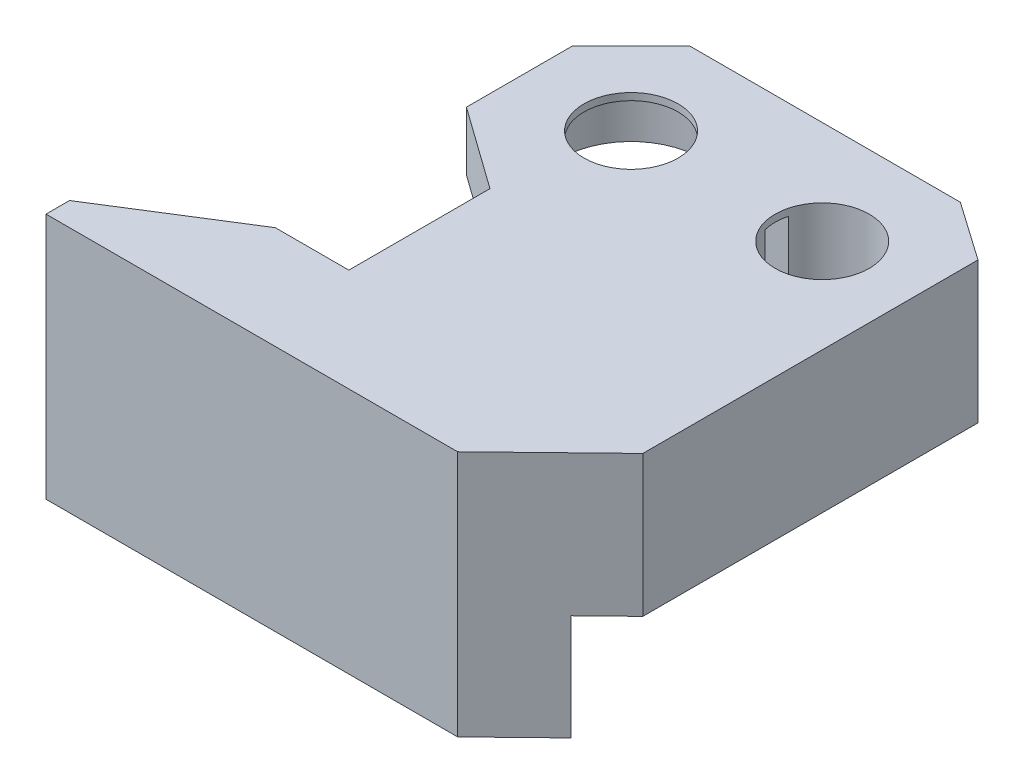
from build123d import *
from build123d.topology import SkipClean

# Parameters (mm, degrees)
SKETCH1_R           = 4
BOSS_EXTRUDE1_DEPTH = 5
BOSS_EXTRUDE2_DEPTH = 7
BOSS_EXTRUDE3_DEPTH = 16
BOSS_EXTRUDE4_START = 2.5
SKETCH6_R           = 7
SKETCH6_R_2         = 4
BOSS_EXTRUDE4_DEPTH = 2.5
CUT_EXTRUDE1_DEPTH  = 4.4
CUT_EXTRUDE2_DEPTH  = 45.33083013


with BuildPart() as part:
    # Sketch1 → Boss-Extrude1 (new body)
    with BuildSketch(Plane(origin=(0, 0, 0), x_dir=(1, 0, 0), z_dir=(0, 1, 0))):
        Polygon((-3.75, 8.75), (19.25, 8.75), (24.25, 5.25), (24.25, -23.25), (16.25, -31), (-18.75, -31), (-18.75, -29), (-8, -22.25), (-1.75, -22.25), (-1.75, -10.25), (-8.75, -5.25), (-8.75, 3.75), align=None)
        with Locations(Location((0, 0, 0), (0, 0, 270))):
            Circle(SKETCH1_R, mode=Mode.SUBTRACT)
        with Locations(Location((16.25, 0, 0), (0, 0, 270))):
            Circle(SKETCH1_R, mode=Mode.SUBTRACT)
    extrude(amount=BOSS_EXTRUDE1_DEPTH)

    # Sketch2 → Boss-Extrude2 (add)
    with BuildSketch(Plane.XZ):
        Polygon((24.25, 23.25), (24.25, -5.25), (20.75, -5.25), (20.75, 22.25), (-8, 22.25), (-14.37037037, 26.25), (21.153225806, 26.25), align=None)
    extrude(amount=BOSS_EXTRUDE2_DEPTH)

    # Sketch3 → Boss-Extrude3 (add)
    with BuildSketch(Plane.XZ):
        Polygon((-14.37037037, 26.25), (21.153225806, 26.25), (16.25, 31), (-18.75, 31), (-18.75, 29), align=None)
    extrude(amount=BOSS_EXTRUDE3_DEPTH)

    # Sketch6 → Boss-Extrude4 (add)
    with SkipClean():  # the faces are left unmerged after this step: merging them gives an invalid solid
        with BuildSketch(Plane.XZ.offset(BOSS_EXTRUDE4_START)):
            with Locations((16.25, 0)):
                Circle(SKETCH6_R)
            with Locations(Location((16.25, 0, 0), (0, 0, 270))):
                Circle(SKETCH6_R_2, mode=Mode.SUBTRACT)
        extrude(amount=-BOSS_EXTRUDE4_DEPTH)

    # Sketch4 → Cut-Extrude1 (cut)
    with SkipClean():  # the faces are left unmerged after this step: merging them gives an invalid solid
        with BuildSketch(Plane.XZ):
            with BuildLine():
                Line((5.883782294, -1), (12.377016654, -1))
                ThreePointArc((12.377016654, -1), (12.25, 0), (12.377016654, 1))
                Line((12.377016654, 1), (5.883782294, 1))
                ThreePointArc((5.883782294, 1), (-5.968156673, 0), (5.883782294, -1))
            make_face()
        extrude(amount=-CUT_EXTRUDE1_DEPTH, mode=Mode.SUBTRACT)

    # Sketch7 → Cut-Extrude2 (cut, through all)
    with SkipClean():  # the faces are left unmerged after this step: merging them gives an invalid solid
        with BuildSketch(Plane.XZ.offset(-4.4)):
            with BuildLine():
                Line((5.883782294, -1), (12.377016654, -1))
                ThreePointArc((12.377016654, -1), (12.25, 0), (12.377016654, 1))
                Line((12.377016654, 1), (5.883782294, 1))
                ThreePointArc((5.883782294, 1), (-5.968156673, 0), (5.883782294, -1))
            make_face()
        extrude(amount=CUT_EXTRUDE2_DEPTH, mode=Mode.SUBTRACT)


solid = part.part
